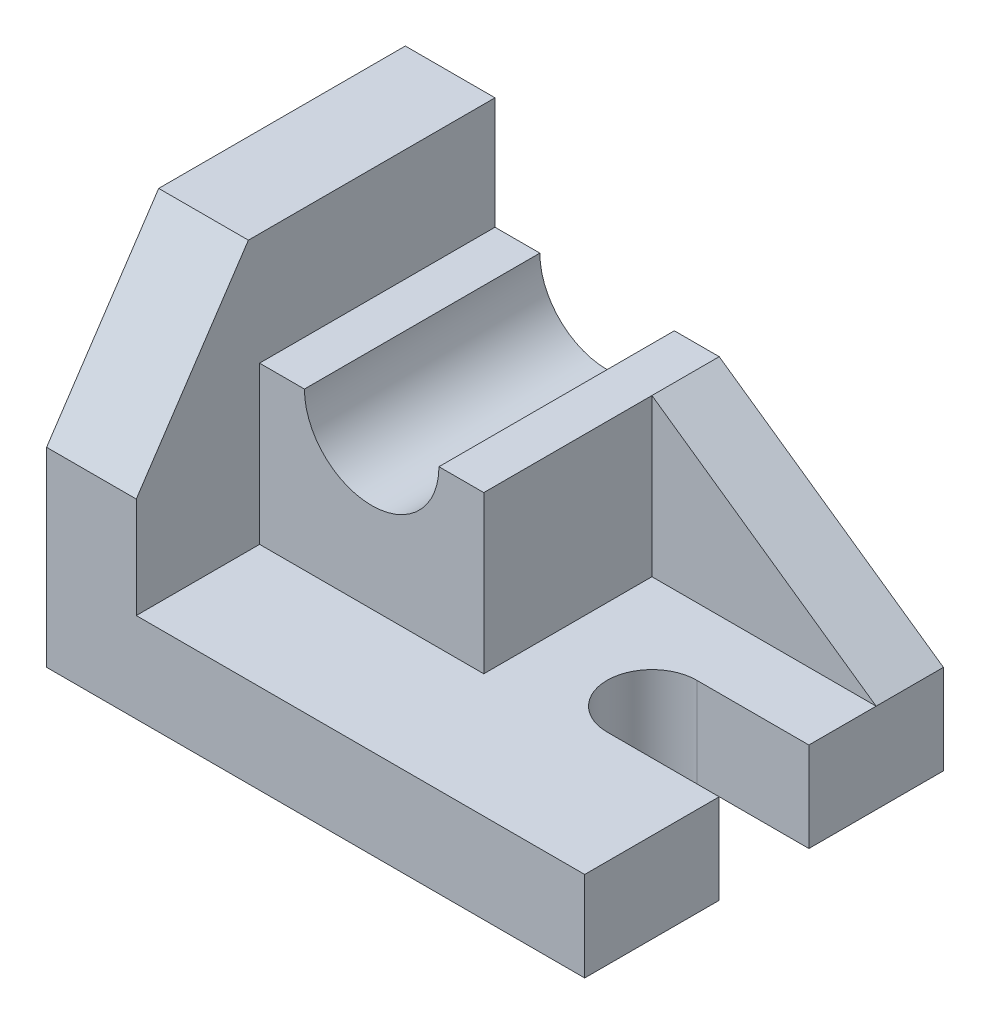
from build123d import *

# Parameters (mm, degrees)
BOSS_EXTRUDE1_DEPTH     = 406.4
SKETCH2_W               = 406.4
SKETCH2_H               = 1625.6
BOSS_EXTRUDE2_DEPTH     = 1219.2
CUT_EXTRUDE1_DEPTH      = 3069.252714494
CUT_EXTRUDE1_DEPTH_BACK = 1219.2
SKETCH4_W               = 1016
SKETCH4_H               = 304.8
BOSS_EXTRUDE3_DEPTH     = 711.2
SKETCH5_R               = 304.8
CUT_EXTRUDE2_DEPTH      = 3119.722841164
CUT_EXTRUDE3_DEPTH      = 711.2
SCALE1_SCALE            = 0.039370079


with BuildPart() as part:
    # Sketch1 → Boss-Extrude1 (new body)
    with BuildSketch(Plane(origin=(0, 0, 0), x_dir=(1, 0, 0), z_dir=(0, 1, 0))):
        with BuildLine():
            Line((1930.4, 1016), (2438.4, 1016))
            Line((2438.4, 1016), (2438.4, 1625.6))
            Line((2438.4, 1625.6), (0, 1625.6))
            Line((0, 1625.6), (0, 0))
            Line((0, 0), (2438.4, 0))
            Line((2438.4, 0), (2438.4, 609.6))
            Line((2438.4, 609.6), (1930.4, 609.6))
            ThreePointArc((1930.4, 609.6), (1727.2, 812.8), (1930.4, 1016))
        make_face()
    extrude(amount=BOSS_EXTRUDE1_DEPTH)

    # Sketch2 → Boss-Extrude2 (add)
    with BuildSketch(Plane(origin=(0, 406.4, 0), x_dir=(1, 0, 0), z_dir=(0, 1, 0))):
        with Locations((203.2, 812.8)):
            Rectangle(SKETCH2_W, SKETCH2_H)
    extrude(amount=BOSS_EXTRUDE2_DEPTH)

    # Sketch3 → Cut-Extrude1 (cut, two sides: drawn at the far end of the back side and taken through both)
    with BuildSketch(Plane(origin=(406.4, 0, 0), x_dir=(0, 0, -1), z_dir=(1, 0, 0)).offset(-CUT_EXTRUDE1_DEPTH_BACK)):
        Polygon((0, 1625.6), (0, 863.6), (508, 1625.6), align=None)
    extrude(amount=CUT_EXTRUDE1_DEPTH + CUT_EXTRUDE1_DEPTH_BACK, mode=Mode.SUBTRACT)

    # Sketch4 → Boss-Extrude3 (add)
    with BuildSketch(Plane(origin=(0, 406.4, 0), x_dir=(1, 0, 0), z_dir=(0, 1, 0))):
        Polygon((1422.4, 1625.6), (406.4, 1625.6), (406.4, 558.8), (1422.4, 558.8), (1422.4, 1320.8), align=None)
        with Locations((1930.4, 1473.2)):
            Rectangle(SKETCH4_W, SKETCH4_H)
    extrude(amount=BOSS_EXTRUDE3_DEPTH)

    # Sketch5 → Cut-Extrude2 (cut, through all)
    with BuildSketch(Plane.XY.offset(-558.8)):
        with Locations((914.4, 1117.6)):
            Circle(SKETCH5_R)
    extrude(amount=-CUT_EXTRUDE2_DEPTH, mode=Mode.SUBTRACT)

    # Sketch6 → Cut-Extrude3 (cut)
    with BuildSketch(Plane.XY.offset(-1320.8)):
        Polygon((2438.4, 406.4), (1422.4, 1117.6), (2438.4, 1117.6), align=None)
    extrude(amount=-CUT_EXTRUDE3_DEPTH, mode=Mode.SUBTRACT)


with BuildPart() as part_1:
    # Scale1: scaled about (892.820254443, 514.703381523, -912.780142535)
    add(part.part.scale(SCALE1_SCALE).moved(Location((857.669850725, 494.439468865, -876.843916451))))


solid = part_1.part
